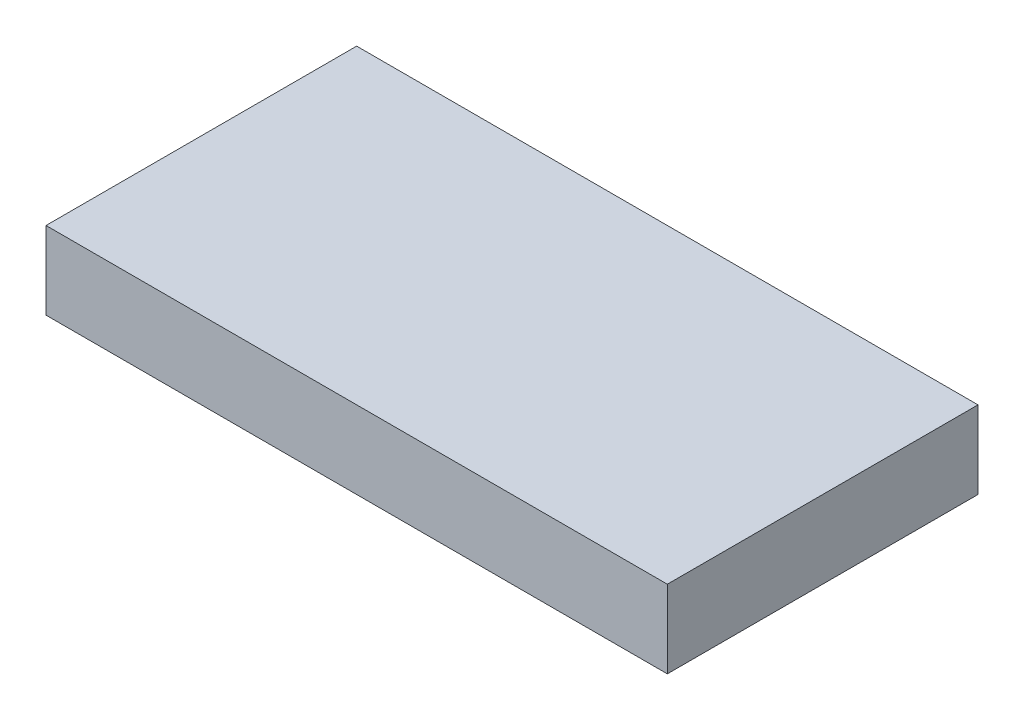
from build123d import *

# Parameters (mm, degrees)
SKETCH1_W           = 400
SKETCH1_H           = 200
BOSS_EXTRUDE1_DEPTH = 50


with BuildPart() as part:
    # Sketch1 → Boss-Extrude1 (new body)
    with BuildSketch(Plane(origin=(0, 0, 0), x_dir=(1, 0, 0), z_dir=(0, 1, 0))):
        Rectangle(SKETCH1_W, SKETCH1_H)
    extrude(amount=BOSS_EXTRUDE1_DEPTH)


solid = part.part
